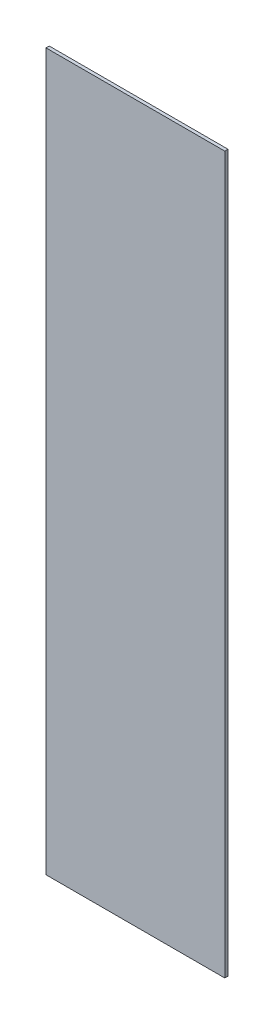
from build123d import *

# Parameters (mm, degrees)
BODY_SKETCH_W = 83
BODY_SKETCH_H = 332.5
BODY_DEPTH    = 1.5


with BuildPart() as part:
    # Body sketch → Body (new body)
    with BuildSketch(Plane.XY):
        with Locations((41.5, 166.25)):
            Rectangle(BODY_SKETCH_W, BODY_SKETCH_H)
    extrude(amount=BODY_DEPTH)


solid = part.part
